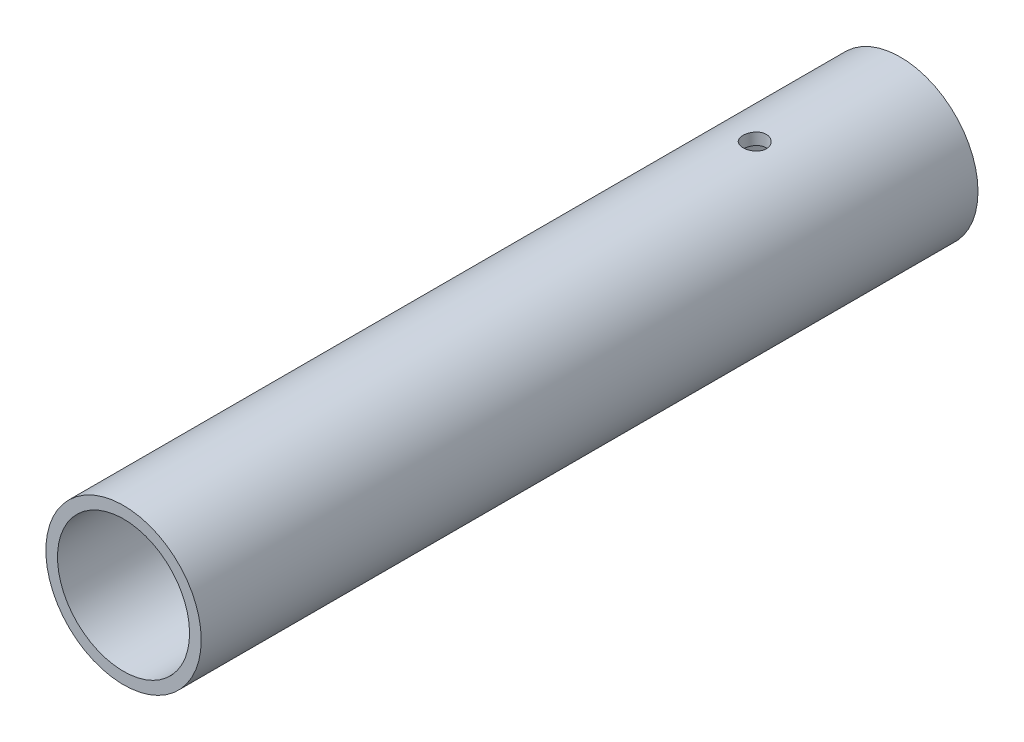
from build123d import *

# Parameters (mm, degrees)
SKETCH1_R               = 20
SKETCH1_R_2             = 17
BOSS_EXTRUDE1_DEPTH     = 100
CUT_EXTRUDE1_DEPTH      = 104.923048454
CUT_EXTRUDE1_DEPTH_BACK = 104.923048454
SKETCH2_R               = 3


with BuildPart() as part:
    # Sketch1 → Boss-Extrude1 (new, symmetric)
    with BuildSketch(Plane.XY):
        Circle(SKETCH1_R)
        Circle(SKETCH1_R_2, mode=Mode.SUBTRACT)
    extrude(amount=BOSS_EXTRUDE1_DEPTH, both=True)

    # Sketch2 → Cut-Extrude1 (cut, two sides: drawn at the far end of the back side and taken through both)
    with BuildSketch(Plane(origin=(0, 0, 0), x_dir=(1, 0, 0), z_dir=(0, 1, 0)).offset(-CUT_EXTRUDE1_DEPTH_BACK)):
        with Locations(Location((0, 62.5, 0), (0, 0, 270))):
            Circle(SKETCH2_R)
    extrude(amount=CUT_EXTRUDE1_DEPTH + CUT_EXTRUDE1_DEPTH_BACK, mode=Mode.SUBTRACT)


solid = part.part
